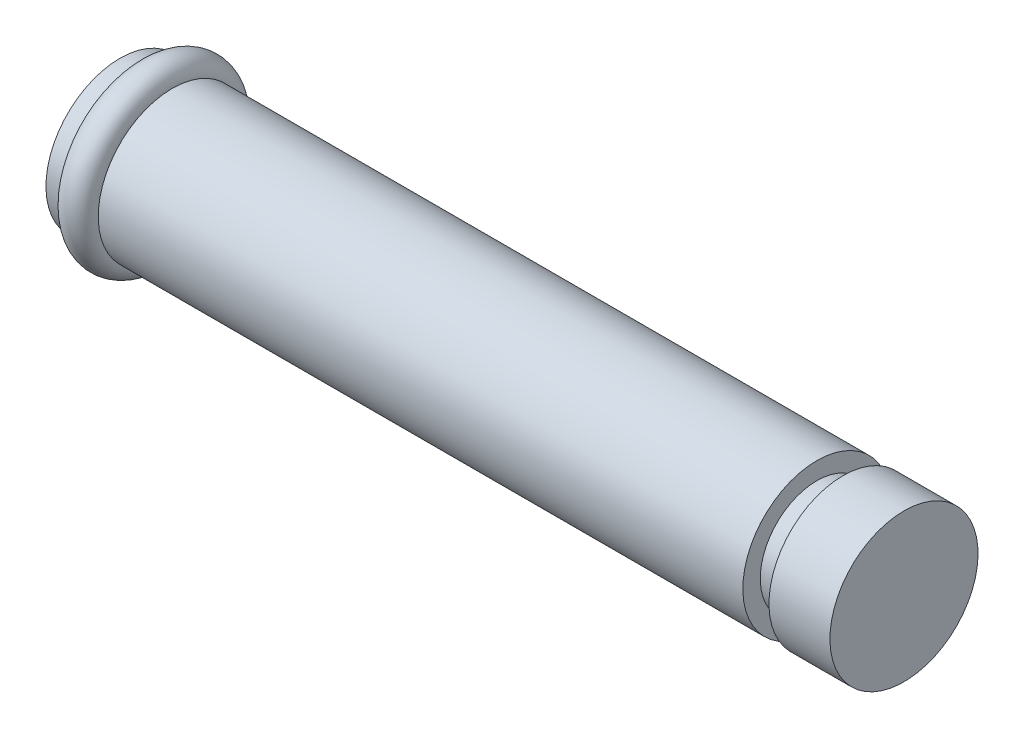
from build123d import *

# Parameters (mm, degrees)
SKETCH2_R = 0.925


with BuildPart() as part:
    # Sketch1 → Revolve1 (revolve)
    with BuildSketch(Plane.XY):
        Polygon((-44, 4.25), (-45, 4.25), (-45, 0), (0, 0), (0, 4.25), (-3.5, 4.25), (-3.5, 3.25), (-5, 3.25), (-5, 4.25), (-42, 4.25), (-42, 3.25), (-44, 3.25), align=None)
    revolve(axis=Axis((0, 0, 0), (-1, 0, 0)))


with BuildPart() as body_2:
    # Sketch2 → Revolve2 (revolve)
    with BuildSketch(Plane.XY, mode=Mode.PRIVATE) as revolve2_sk:
        with Locations((-43.05, 4.2)):
            Circle(SKETCH2_R)
    revolve(revolve2_sk.sketch.rotate(Axis((0, 0, 0), (1, 0, 0)), 180), axis=Axis((0, 0, 0), (1, 0, 0)))


solid = Compound([part.part, body_2.part])
